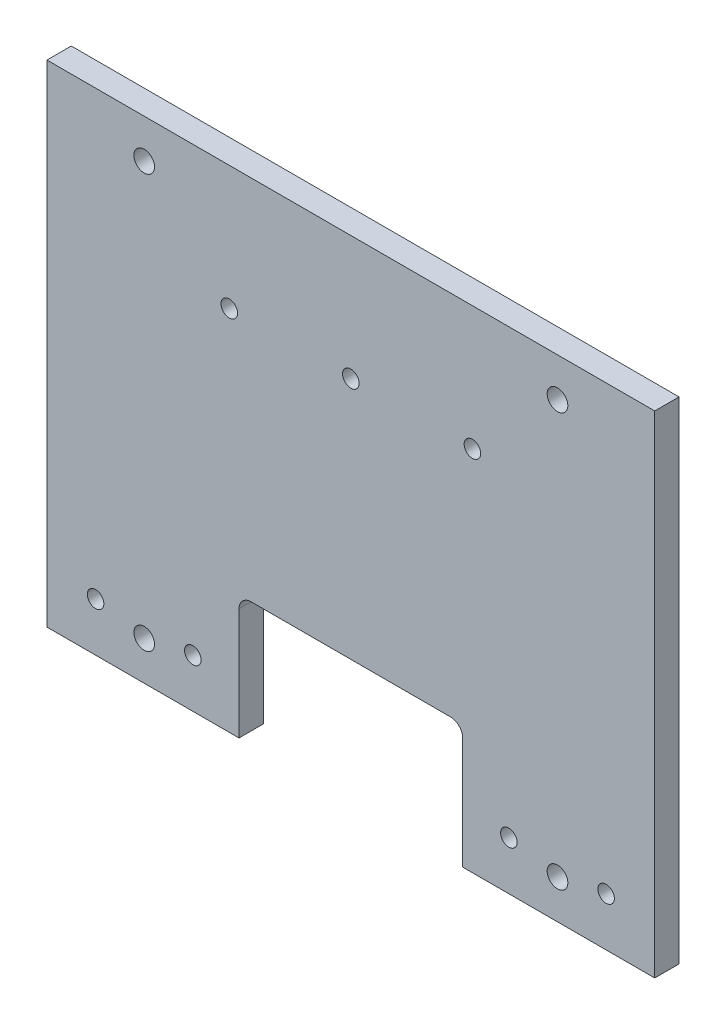
from build123d import *

# Parameters (mm, degrees)
SKETCH_1_R          = 4
EXTRUDE_1_DEPTH     = 10
HOLE_WIZARD_M10_1_D = 8.5
HOLE_WIZARD_M8_1_D  = 6.8


with BuildPart() as part:
    # 草图1 → 凸台-拉伸1 (new body)
    with BuildSketch(Plane.XY):
        with BuildLine():
            Line((125, -101), (125, 101))
            Line((125, 101), (-125, 101))
            Line((-125, 101), (-125, -101))
            Line((-125, -101), (-46, -101))
            Line((-46, -101), (-46, -55))
            ThreePointArc((-46, -55), (-44.535533906, -51.464466094), (-41, -50))
            Line((-41, -50), (41, -50))
            ThreePointArc((41, -50), (44.535533906, -51.464466094), (46, -55))
            Line((46, -55), (46, -101))
            Line((46, -101), (125, -101))
        make_face()
        with Locations((-85, -85)):
            Circle(SKETCH_1_R, mode=Mode.SUBTRACT)
        with Locations((85, -85)):
            Circle(SKETCH_1_R, mode=Mode.SUBTRACT)
        with Locations((-85, 85)):
            Circle(SKETCH_1_R, mode=Mode.SUBTRACT)
        with Locations((85, 85)):
            Circle(SKETCH_1_R, mode=Mode.SUBTRACT)
    extrude(amount=EXTRUDE_1_DEPTH)

    # M10 螺纹孔1 (through all)
    with Locations(Plane.XY.offset(10)):
        with Locations((85, -85), (-85, -85), (-85, 85), (85, 85)):
            Hole(HOLE_WIZARD_M10_1_D / 2)

    # M8 螺纹孔1 (through all)
    with Locations(Plane(origin=(0, 0, 0), x_dir=(-1, 0, 0), z_dir=(0, 0, -1))):
        with Locations((-50, 50), (0, 50), (50, 50), (-105, -81), (-65, -81), (65, -81), (105, -81)):
            Hole(HOLE_WIZARD_M8_1_D / 2)


solid = part.part
